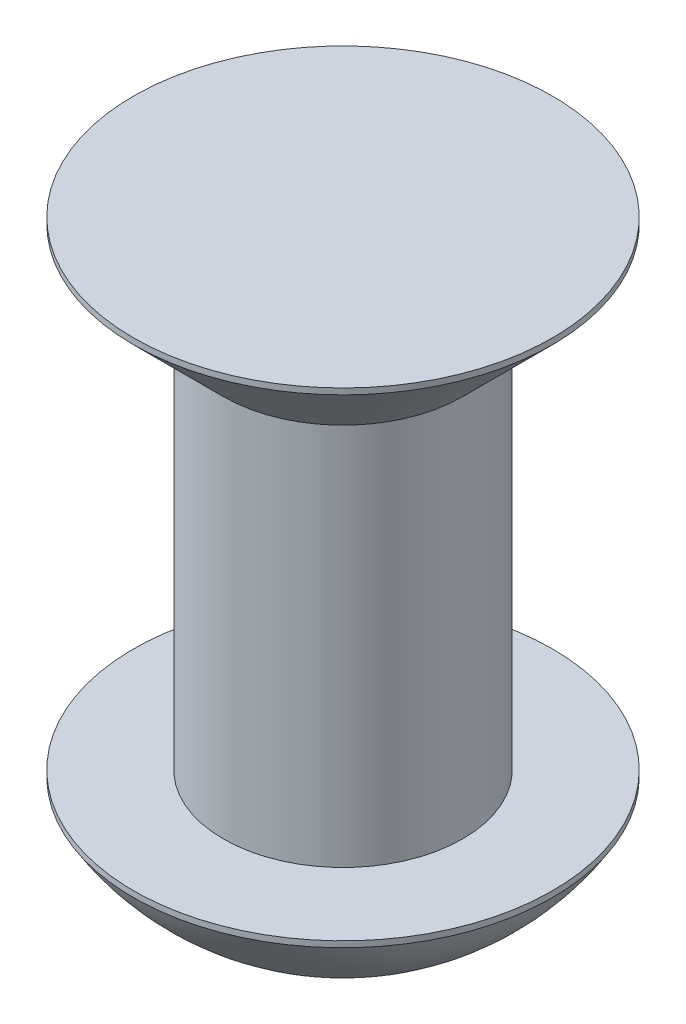
from build123d import *

# Parameters (mm, degrees)
EXTRUDE_1_DEPTH      = 0.4
EXTRUDE_1_DEPTH_BACK = 2
SKETCH_2_R           = 2
SKETCH_3_R           = 3.5
EXTRUDE_2_DEPTH      = 0.1
DOME_1_FACE_RADIUS   = 3.5
DOME_1_HEIGHT        = 2


with BuildPart() as part:
    # Эскиз1 → Revolve 344 (revolve)
    with BuildSketch(Plane.XY, mode=Mode.PRIVATE) as revolve_344_sk:
        with BuildLine():
            Line((0, 0), (1.6, 0))
            ThreePointArc((1.6, 0), (1.882842712, 0.117157288), (2, 0.4))
            Line((2, 0.4), (2, 6))
            Line((2, 6), (3.5, 7.5))
            Line((3.5, 7.5), (3.5, 7.6))
            Line((3.5, 7.6), (0, 7.6))
            Line((0, 7.6), (0, 0))
        make_face()
    revolve(revolve_344_sk.sketch.rotate(Axis((0, 11.283972125, 0), (0, -1, 0)), 90), axis=Axis((0, 11.283972125, 0), (0, -1, 0)))

    # Эскиз2 → Вытянуть1 (add, two sides: drawn at the far end of the back side and taken through both)
    with BuildSketch(Plane.XZ.offset(-EXTRUDE_1_DEPTH_BACK)):
        with Locations(Location((0, 0, 0), (0, 0, 90))):
            Circle(SKETCH_2_R)
    extrude(amount=EXTRUDE_1_DEPTH + EXTRUDE_1_DEPTH_BACK)

    # Эскиз3 → Вытянуть2 (add)
    with BuildSketch(Plane.XZ.offset(0.4)):
        with Locations(Location((0, 0, 0), (0, 0, 90))):
            Circle(SKETCH_3_R)
    extrude(amount=EXTRUDE_2_DEPTH)

    # Купол1: a dome of height H over a round flat face of radius A is a cap of a sphere of radius (A * A + H * H) / (2 * H)
    dome_1_r = (DOME_1_FACE_RADIUS * DOME_1_FACE_RADIUS + DOME_1_HEIGHT * DOME_1_HEIGHT) / (2 * DOME_1_HEIGHT)
    dome_1_base = Plane((0, -0.5, 0), z_dir=(0, -1, 0))
    with Locations(dome_1_base.offset(DOME_1_HEIGHT - dome_1_r)):
        dome_1_ball = Sphere(dome_1_r, mode=Mode.PRIVATE)
    add(split(dome_1_ball, bisect_by=dome_1_base, keep=Keep.TOP, mode=Mode.PRIVATE))


solid = part.part
